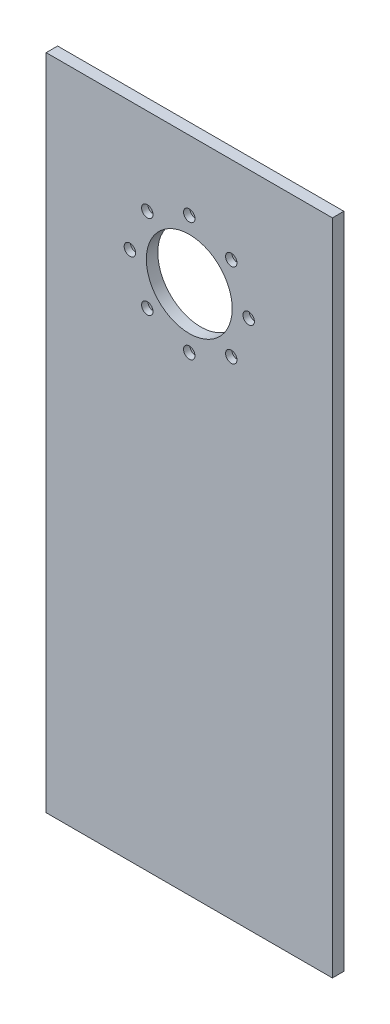
from build123d import *

# Parameters (mm, degrees)
SKETCH_1_W          = 200
SKETCH_1_H          = 460
EXTRUDE_1_DEPTH     = 8
SKETCH_2_R          = 30
CUT_EXTRUDE_1_DEPTH = 10
SKETCH_3_R          = 2.25
CUT_EXTRUDE_2_DEPTH = 10
SKETCH_4_R          = 4
CUT_EXTRUDE_3_DEPTH = 4.4


with BuildPart() as part:
    # 草图1 → 凸台-拉伸1 (new body)
    with BuildSketch(Plane.XY):
        with Locations((0, 230)):
            Rectangle(SKETCH_1_W, SKETCH_1_H)
    extrude(amount=EXTRUDE_1_DEPTH)

    # 草图2 → 切除-拉伸1 (cut)
    with BuildSketch(Plane(origin=(0, 0, 0), x_dir=(-1, 0, 0), z_dir=(0, 0, -1))):
        with Locations((0, 370)):
            Circle(SKETCH_2_R)
    extrude(amount=-CUT_EXTRUDE_1_DEPTH, mode=Mode.SUBTRACT)

    # 草图3 → 切除-拉伸2 (cut)
    with BuildSketch(Plane(origin=(0, 0, 0), x_dir=(-1, 0, 0), z_dir=(0, 0, -1))):
        with Locations((0, 411.5)):
            Circle(SKETCH_3_R)
        with Locations((29.344931419, 399.344931419)):
            Circle(SKETCH_3_R)
        with Locations((41.5, 370)):
            Circle(SKETCH_3_R)
        with Locations((29.344931419, 340.655068581)):
            Circle(SKETCH_3_R)
        with Locations((0, 328.5)):
            Circle(SKETCH_3_R)
        with Locations((-29.344931419, 340.655068581)):
            Circle(SKETCH_3_R)
        with Locations((-41.5, 370)):
            Circle(SKETCH_3_R)
        with Locations((-29.344931419, 399.344931419)):
            Circle(SKETCH_3_R)
    extrude(amount=-CUT_EXTRUDE_2_DEPTH, mode=Mode.SUBTRACT)

    # 草图4 → 切除-拉伸3 (cut)
    with BuildSketch(Plane.XY.offset(8)):
        with Locations((29.344931419, 399.344931419)):
            Circle(SKETCH_4_R)
        with Locations((41.5, 370)):
            Circle(SKETCH_4_R)
        with Locations((29.344931419, 340.655068581)):
            Circle(SKETCH_4_R)
        with Locations((0, 328.5)):
            Circle(SKETCH_4_R)
        with Locations((-29.344931419, 340.655068581)):
            Circle(SKETCH_4_R)
        with Locations((-41.5, 370)):
            Circle(SKETCH_4_R)
        with Locations((-29.344931419, 399.344931419)):
            Circle(SKETCH_4_R)
        with Locations((0, 411.5)):
            Circle(SKETCH_4_R)
    extrude(amount=-CUT_EXTRUDE_3_DEPTH, mode=Mode.SUBTRACT)


solid = part.part
